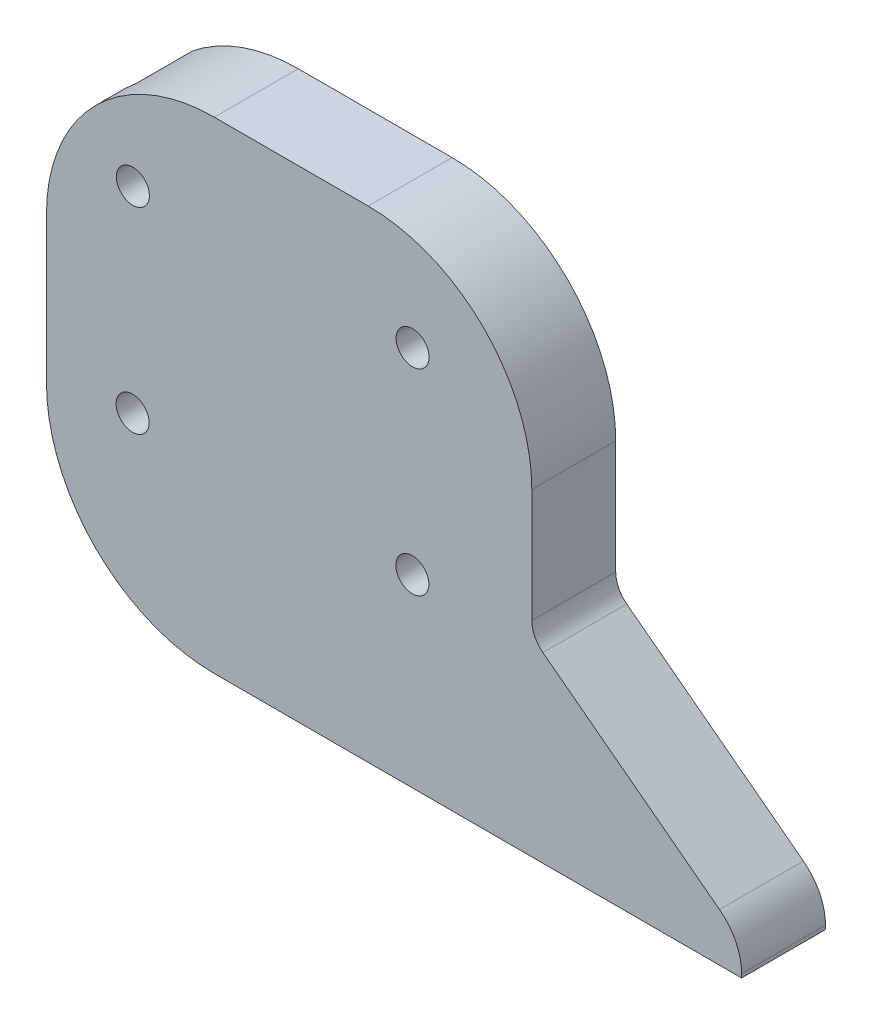
from build123d import *

# Parameters (mm, degrees)
BOSS_EXTRUDE1_DEPTH             = 7.62
SKETCH1_3_R                     = 1.5
BOSS_EXTRUDE2_DEPTH             = 2.54
SKETCH2_W                       = 63.119
SKETCH2_H                       = 7.62
BOSS_EXTRUDE3_DEPTH             = 2.54
BOSS_EXTRUDE3_DIRECTION_2_REACH = 58.274
FILLET1_R                       = 15.24
FILLET2_R                       = 5.08
FILLET3_R                       = 2.54


with BuildPart() as part:
    # Sketch1 → Boss-Extrude1 (new body)
    with BuildSketch(Plane.XY):
        with BuildLine():
            Line((-37.554226409, 19.773329444), (-37.554226409, 16.344329444))
            Line((-37.554226409, 16.344329444), (-8.344226409, 16.344329444))
            ThreePointArc((-8.344226409, 16.344329444), (-0.261995901, 12.996559953), (3.085773591, 4.914329444))
            Line((3.085773591, 4.914329444), (3.085773591, -14.770670556))
            Line((3.085773591, -14.770670556), (-37.554226409, -14.770670556))
            Line((-37.554226409, -14.770670556), (-37.554226409, -21.438170556))
            Line((-37.554226409, -21.438170556), (6.514773591, -21.438170556))
            Line((6.514773591, -21.438170556), (25.564773591, -21.120670556))
            Line((25.564773591, -21.120670556), (6.514773591, -6.642670556))
            Line((6.514773591, -6.642670556), (6.514773591, 4.914329444))
            ThreePointArc((6.514773591, 4.914329444), (2.162673252, 15.421229106), (-8.344226409, 19.773329444))
            Line((-8.344226409, 19.773329444), (-37.554226409, 19.773329444))
        make_face()
    extrude(amount=-BOSS_EXTRUDE1_DEPTH)

    # Sketch1<3> → Boss-Extrude2 (add)
    with BuildSketch(Plane.XY):
        with BuildLine():
            Line((-8.344226409, 16.344329444), (-37.554226409, 16.344329444))
            Line((-37.554226409, 16.344329444), (-37.554226409, -14.770670556))
            Line((-37.554226409, -14.770670556), (3.085773591, -14.770670556))
            Line((3.085773591, -14.770670556), (3.085773591, 4.914329444))
            ThreePointArc((3.085773591, 4.914329444), (-0.261995901, 12.996559953), (-8.344226409, 16.344329444))
        make_face()
        with Locations((-29.732882342, -7.215397763)):
            Circle(SKETCH1_3_R, mode=Mode.SUBTRACT)
        with Locations((-4.332882342, -7.215397763)):
            Circle(SKETCH1_3_R, mode=Mode.SUBTRACT)
        with Locations((-29.710505244, 10.645398587)):
            Circle(SKETCH1_3_R, mode=Mode.SUBTRACT)
        with Locations((-4.310505244, 10.645398587)):
            Circle(SKETCH1_3_R, mode=Mode.SUBTRACT)
    extrude(amount=-BOSS_EXTRUDE2_DEPTH)

    # Sketch2 → Boss-Extrude3 (add)
    with BuildSketch(Plane.XZ.offset(21.438170556)):
        with Locations((-5.994726409, -3.81)):
            Rectangle(SKETCH2_W, SKETCH2_H)
    extrude(amount=BOSS_EXTRUDE3_DEPTH)

    # Boss-Extrude3 direction 2: up to this face of the body (flat: up to its plane)
    boss_extrude3_direction_2_end = Plane(part.part.faces().sort_by_distance((16.039773591, -21.279420556, -3.81))[0])
    # Sketch2 → Boss-Extrude3 direction 2 (add, up to the picked face)
    with BuildSketch(Plane.XZ.offset(21.438170556), mode=Mode.PRIVATE) as boss_extrude3_direction_2_sk1:
        with Locations((-5.994726409, -3.81)):
            Rectangle(SKETCH2_W, SKETCH2_H)
    boss_extrude3_direction_2_tool1 = split(extrude(boss_extrude3_direction_2_sk1.sketch, amount=-BOSS_EXTRUDE3_DIRECTION_2_REACH, mode=Mode.PRIVATE), bisect_by=boss_extrude3_direction_2_end, keep=Keep.BOTH, mode=Mode.PRIVATE)
    add(boss_extrude3_direction_2_tool1.solids().sort_by(Axis((-5.994726, -21.438171, -3.81), (0, 1, 0)))[0])

    # Fillet1
    fillet1_edges = [part.edges().sort_by_distance(p)[0] for p in [
        (-37.554226409, 19.773329444, -3.81),
        (-37.554226409, -23.978170556, -3.81),
    ]]
    fillet(fillet1_edges, radius=FILLET1_R)

    # Fillet2
    fillet2_edges = [part.edges().sort_by_distance(p)[0] for p in [
        (25.564773591, -21.120670556, -3.81),
    ]]
    fillet(fillet2_edges, radius=FILLET2_R)

    # Fillet3
    fillet3_edges = [part.edges().sort_by_distance(p)[0] for p in [
        (6.514773591, -6.642670556, -3.81),
    ]]
    fillet(fillet3_edges, radius=FILLET3_R)


solid = part.part
